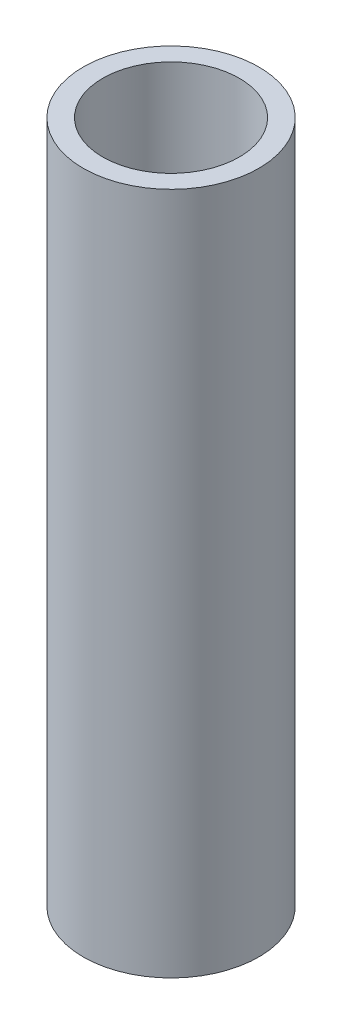
from build123d import *

# Parameters (mm, degrees)
SKETCH1_R           = 9
SKETCH1_R_2         = 7
BOSS_EXTRUDE1_DEPTH = 70


with BuildPart() as part:
    # Sketch1 → Boss-Extrude1 (new body)
    with BuildSketch(Plane(origin=(0, 0, 0), x_dir=(1, 0, 0), z_dir=(0, 1, 0))):
        with Locations(Location((0, 0, 0), (0, 0, 270))):
            Circle(SKETCH1_R)
        with Locations(Location((0, 0, 0), (0, 0, 270))):
            Circle(SKETCH1_R_2, mode=Mode.SUBTRACT)
    extrude(amount=BOSS_EXTRUDE1_DEPTH)


solid = part.part
